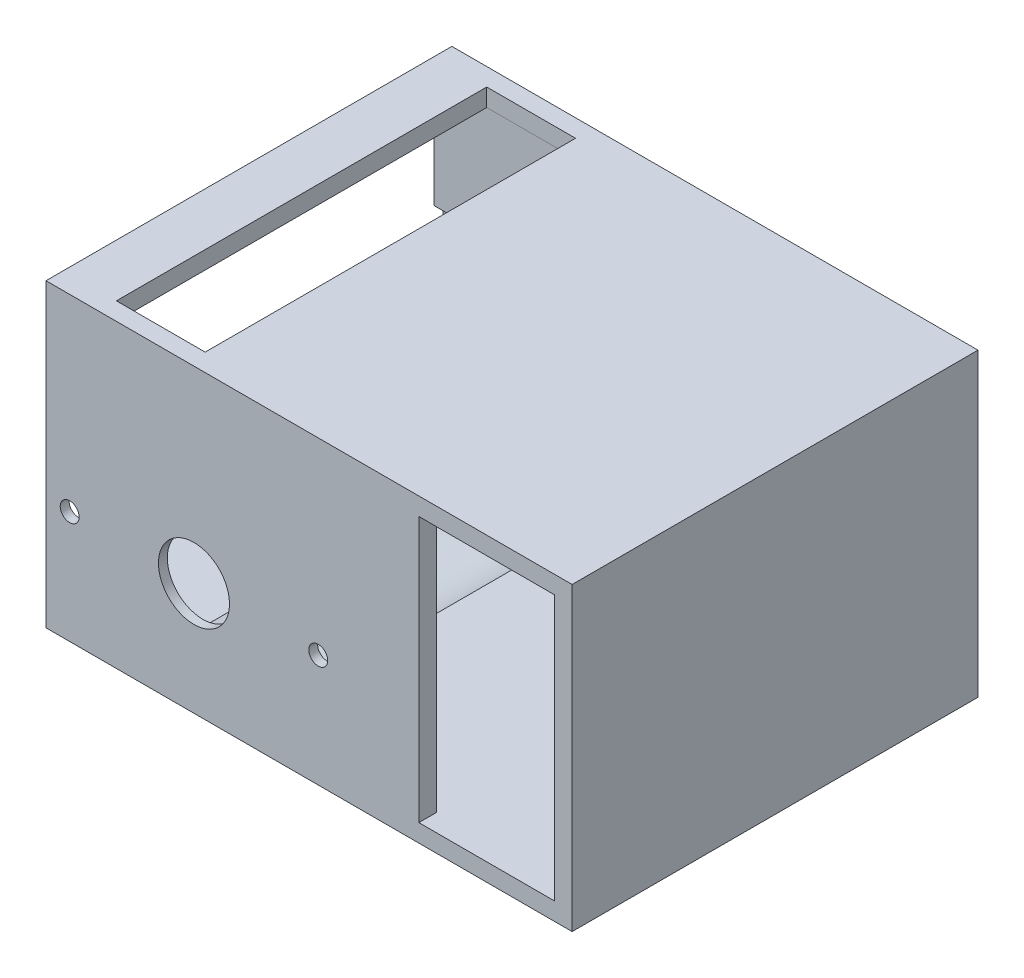
from build123d import *

# Parameters (mm, degrees)
SKETCH1_W           = 88.9
SKETCH1_H           = 50.8
BOSS_EXTRUDE1_DEPTH = 68.58
SHELL10_T           = 3
SKETCH4_W           = 62.58
SKETCH4_H           = 44.8
CUT_EXTRUDE2_DEPTH  = 10
SKETCH2_R           = 6
SKETCH2_R_2         = 1.6
SKETCH2_W           = 22.9
SKETCH2_H           = 44.8
CUT_EXTRUDE3_DEPTH  = 68.59
SKETCH5_R           = 18.3
CUT_EXTRUDE4_DEPTH  = 62.58
CUT_EXTRUDE7_START  = -1.5
SKETCH10_R          = 1.6
SKETCH10_R_2        = 6
CUT_EXTRUDE7_DEPTH  = 1.5
SKETCH10_8_R        = 1.6
SKETCH10_8_R_2      = 6
CUT_EXTRUDE8_DEPTH  = 64.08
SKETCH12_W          = 15.003225859
SKETCH12_H          = 62.579342489
CUT_EXTRUDE9_DEPTH  = 3


with BuildPart() as part:
    # Sketch1 → Boss-Extrude1 (new body)
    with BuildSketch(Plane.XY):
        with Locations((44.45, 25.4)):
            Rectangle(SKETCH1_W, SKETCH1_H)
    extrude(amount=BOSS_EXTRUDE1_DEPTH)

    # Shell10 (no face opened: a closed hollow body)
    add(offset(amount=-SHELL10_T, mode=Mode.PRIVATE), mode=Mode.SUBTRACT)

    # Sketch4 → Cut-Extrude2 (cut)
    with BuildSketch(Plane.ZY):
        with Locations((34.29, 25.4)):
            Rectangle(SKETCH4_W, SKETCH4_H)
    extrude(amount=-CUT_EXTRUDE2_DEPTH, mode=Mode.SUBTRACT)

    # Sketch2 → Cut-Extrude3 (cut)
    with BuildSketch(Plane.XY.offset(68.58)):
        with Locations((25, 19)):
            Circle(SKETCH2_R)
        with Locations((4, 19)):
            Circle(SKETCH2_R_2)
        with Locations((46, 19)):
            Circle(SKETCH2_R_2)
        with Locations((74.45, 25.4)):
            Rectangle(SKETCH2_W, SKETCH2_H)
    extrude(amount=-CUT_EXTRUDE3_DEPTH, mode=Mode.SUBTRACT)

    # Sketch5 → Cut-Extrude4 (cut)
    with BuildSketch(Plane(origin=(0, 0, 65.58), x_dir=(-1, 0, 0), z_dir=(0, 0, -1))):
        with Locations((-25, 19)):
            Circle(SKETCH5_R)
    extrude(amount=CUT_EXTRUDE4_DEPTH, mode=Mode.SUBTRACT)

    # Sketch10 → Cut-Extrude7 (cut)
    with BuildSketch(Plane(origin=(0, 0, 65.58), x_dir=(-1, 0, 0), z_dir=(0, 0, -1)).offset(CUT_EXTRUDE7_START)):
        with BuildLine():
            Line((-10.033370453, 9), (0, 9))
            Line((0, 9), (0, 29))
            Line((0, 29), (-10.033370453, 29))
            ThreePointArc((-10.033370453, 29), (-25, 37), (-39.966629547, 29))
            Line((-39.966629547, 29), (-50, 29))
            Line((-50, 29), (-50, 9))
            Line((-50, 9), (-39.966629547, 9))
            ThreePointArc((-39.966629547, 9), (-25, 1), (-10.033370453, 9))
        make_face()
        with Locations((-4, 19)):
            Circle(SKETCH10_R, mode=Mode.SUBTRACT)
        with Locations((-25, 19)):
            Circle(SKETCH10_R_2, mode=Mode.SUBTRACT)
        with Locations((-46, 19)):
            Circle(SKETCH10_R, mode=Mode.SUBTRACT)
    extrude(amount=CUT_EXTRUDE7_DEPTH, mode=Mode.SUBTRACT)

    # Sketch10<8> → Cut-Extrude8 (cut)
    with BuildSketch(Plane(origin=(0, 0, 65.58), x_dir=(-1, 0, 0), z_dir=(0, 0, -1))):
        with BuildLine():
            Line((-10.033370453, 9), (0, 9))
            Line((0, 9), (0, 29))
            Line((0, 29), (-10.033370453, 29))
            ThreePointArc((-10.033370453, 29), (-25, 37), (-39.966629547, 29))
            Line((-39.966629547, 29), (-50, 29))
            Line((-50, 29), (-50, 9))
            Line((-50, 9), (-39.966629547, 9))
            ThreePointArc((-39.966629547, 9), (-25, 1), (-10.033370453, 9))
        make_face()
        with Locations((-4, 19)):
            Circle(SKETCH10_8_R, mode=Mode.SUBTRACT)
        with Locations((-25, 19)):
            Circle(SKETCH10_8_R_2, mode=Mode.SUBTRACT)
        with Locations((-46, 19)):
            Circle(SKETCH10_8_R, mode=Mode.SUBTRACT)
    extrude(amount=CUT_EXTRUDE8_DEPTH, mode=Mode.SUBTRACT)

    # Sketch12 → Cut-Extrude9 (cut)
    with BuildSketch(Plane(origin=(0, 50.8, 0), x_dir=(1, 0, 0), z_dir=(0, 1, 0))):
        with Locations((16.393449041, -34.290328755)):
            Rectangle(SKETCH12_W, SKETCH12_H)
    extrude(amount=-CUT_EXTRUDE9_DEPTH, mode=Mode.SUBTRACT)


solid = part.part
